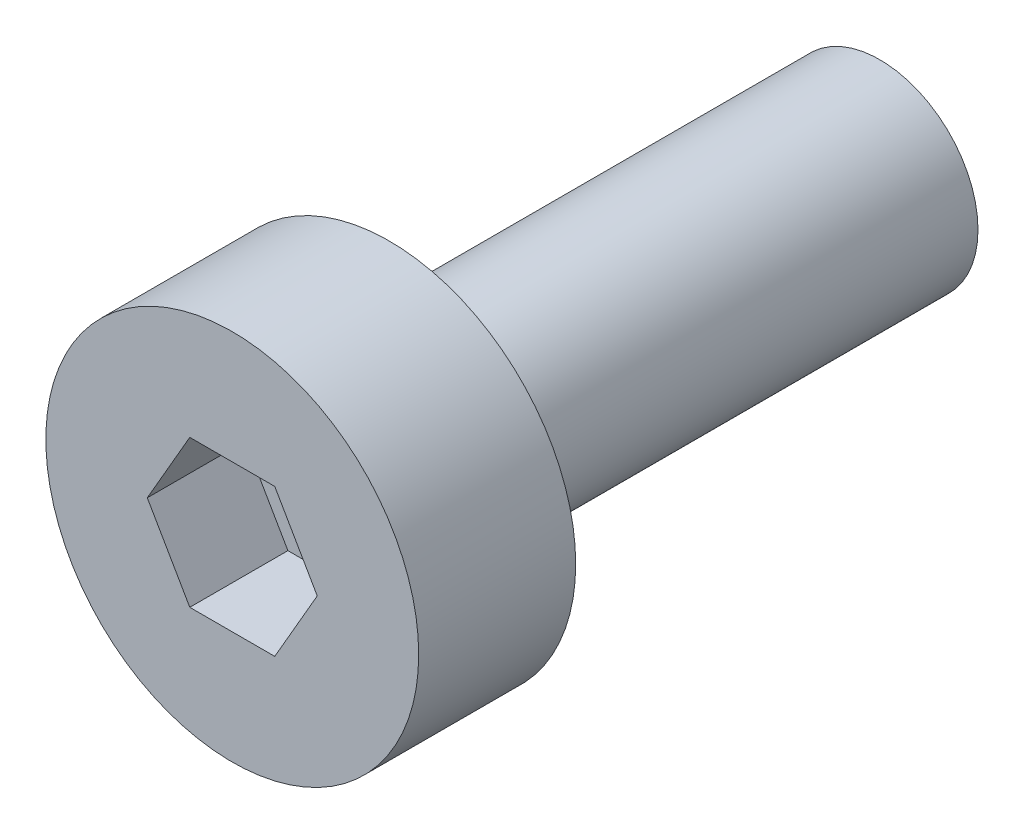
from build123d import *

# Parameters (mm, degrees)
ESQUISSE1_R             = 1
BOSS_EXTRU_1_DEPTH      = 5
ESQUISSE2_R             = 1.9
BOSS_EXTRU_2_DEPTH      = 1.6
ENL_V_MAT_EXTRU_1_DEPTH = 1


with BuildPart() as part:
    # Esquisse1 → Boss.-Extru.1 (new body)
    with BuildSketch(Plane.XY):
        Circle(ESQUISSE1_R)
    extrude(amount=BOSS_EXTRU_1_DEPTH)

    # Esquisse2 → Boss.-Extru.2 (add)
    with BuildSketch(Plane.XY.offset(5)):
        Circle(ESQUISSE2_R)
    extrude(amount=BOSS_EXTRU_2_DEPTH)

    # Esquisse3 → Enlèv. mat.-Extru.1 (cut)
    with BuildSketch(Plane.XY.offset(6.6)):
        Polygon((0.866025404, 0), (0.433012702, 0.75), (-0.433012702, 0.75), (-0.866025404, 0), (-0.433012702, -0.75), (0.433012702, -0.75), align=None)
    extrude(amount=-ENL_V_MAT_EXTRU_1_DEPTH, mode=Mode.SUBTRACT)


solid = part.part
